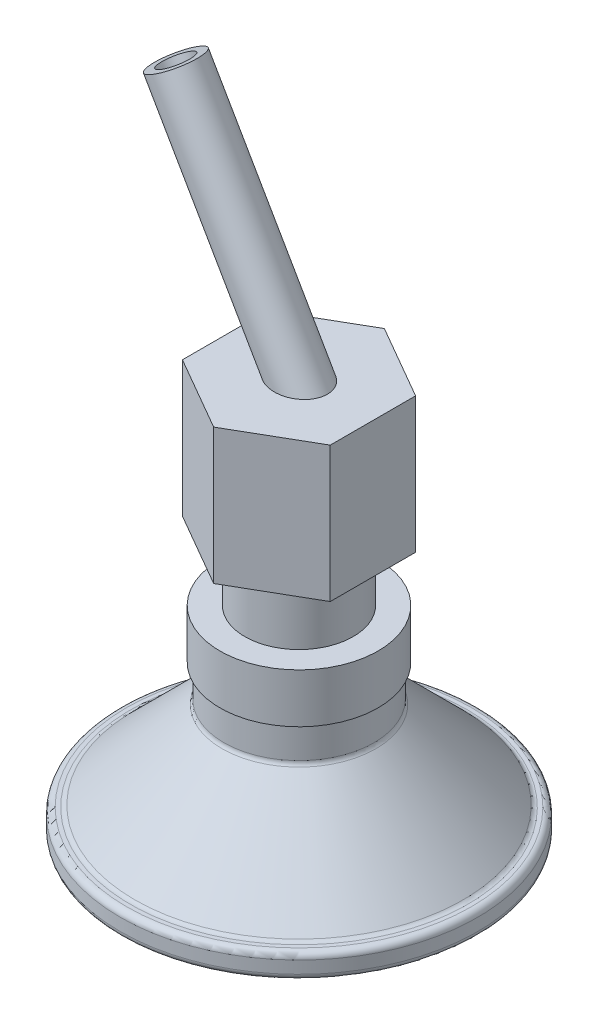
from build123d import *

# Parameters (mm, degrees)
CONG_1_R                = 0.5
BOSS_EXTRU_1_START      = 11
ESQUISSE3_R             = 2
BOSS_EXTRU_1_DEPTH      = 11
BOSS_EXTRU_3_DEPTH      = 20
BOSS_EXTRU_3_DEPTH_BACK = 3
ESQUISSE5_R             = 2
ESQUISSE5_R_2           = 1.3


with BuildPart() as part:
    # Esquisse1 → Révolution1 (revolve)
    with BuildSketch(Plane.XY, mode=Mode.PRIVATE) as r_volution1_sk:
        Polygon((4.4, 10.152592593), (4.4, 5.152592593), (6.420740741, 5.152592593), (6.420740741, 1.152592593), (2, 1.152592593), (2, 10.152592593), align=None)
    revolve(r_volution1_sk.sketch.rotate(Axis((0, 1.898518519, 0), (0, 1, 0)), 90), axis=Axis((0, 1.898518519, 0), (0, 1, 0)))

    # Esquisse3 → Boss.-Extru.1 (add)
    with BuildSketch(Plane(origin=(0, 10.152592593, 0), x_dir=(1, 0, 0), z_dir=(0, 1, 0)).offset(BOSS_EXTRU_1_START)):
        Polygon((6, 3.464101615), (0, 6.92820323), (-6, 3.464101615), (-6, -3.464101615), (0, -6.92820323), (6, -3.464101615), align=None)
        with Locations(Location((0, 0, 0), (0, 0, 90))):
            Circle(ESQUISSE3_R, mode=Mode.SUBTRACT)
    extrude(amount=-BOSS_EXTRU_1_DEPTH)


with BuildPart() as body_2:
    # Esquisse2 → Révolution2 (revolve)
    with BuildSketch(Plane.XY, mode=Mode.PRIVATE) as r_volution2_sk:
        Polygon((6.1, 1.152592593), (6.1, -1.659551209), (13.476266742, -9.035817951), (14.500695366, -9.035817951), (14.500695366, -11.035817951), (6.591394886, -11.035817951), (6.591394886, -9.035817951), (12.06205318, -9.035817951), (5.1, -2.073764772), (5.1, 1.152592593), align=None)
    revolve(r_volution2_sk.sketch.rotate(Axis((0, 10.152592593, 0), (0, -1, 0)), 90), axis=Axis((0, 10.152592593, 0), (0, -1, 0)))

    # Congé1
    cong_1_edges = [body_2.edges().sort_by_distance(p)[0] for p in [
        (0, -9.035817951, -13.476266742),
        (0, -1.659551209, -6.1),
        (0, -11.035817951, -14.500695366),
        (0, -9.035817951, -14.500695366),
    ]]
    fillet(cong_1_edges, radius=CONG_1_R)


with BuildPart() as body_3:
    # Esquisse5 → Boss.-Extru.3 (new, two sides: drawn at the far end of the back side and taken through both)
    with BuildSketch(Plane(origin=(0, 21.152592593, 0), x_dir=(0.8660254037844362, 0.5000000000000042, 0), z_dir=(-0.5000000000000043, 0.8660254037844363, 0)).offset(-BOSS_EXTRU_3_DEPTH_BACK)):
        with Locations(Location((0, 0, 0), (0, 0, 180))):
            Circle(ESQUISSE5_R)
        with Locations(Location((0, 0, 0), (0, 0, 180))):
            Circle(ESQUISSE5_R_2, mode=Mode.SUBTRACT)
    extrude(amount=BOSS_EXTRU_3_DEPTH + BOSS_EXTRU_3_DEPTH_BACK)


solid = Compound([part.part, body_2.part, body_3.part])
